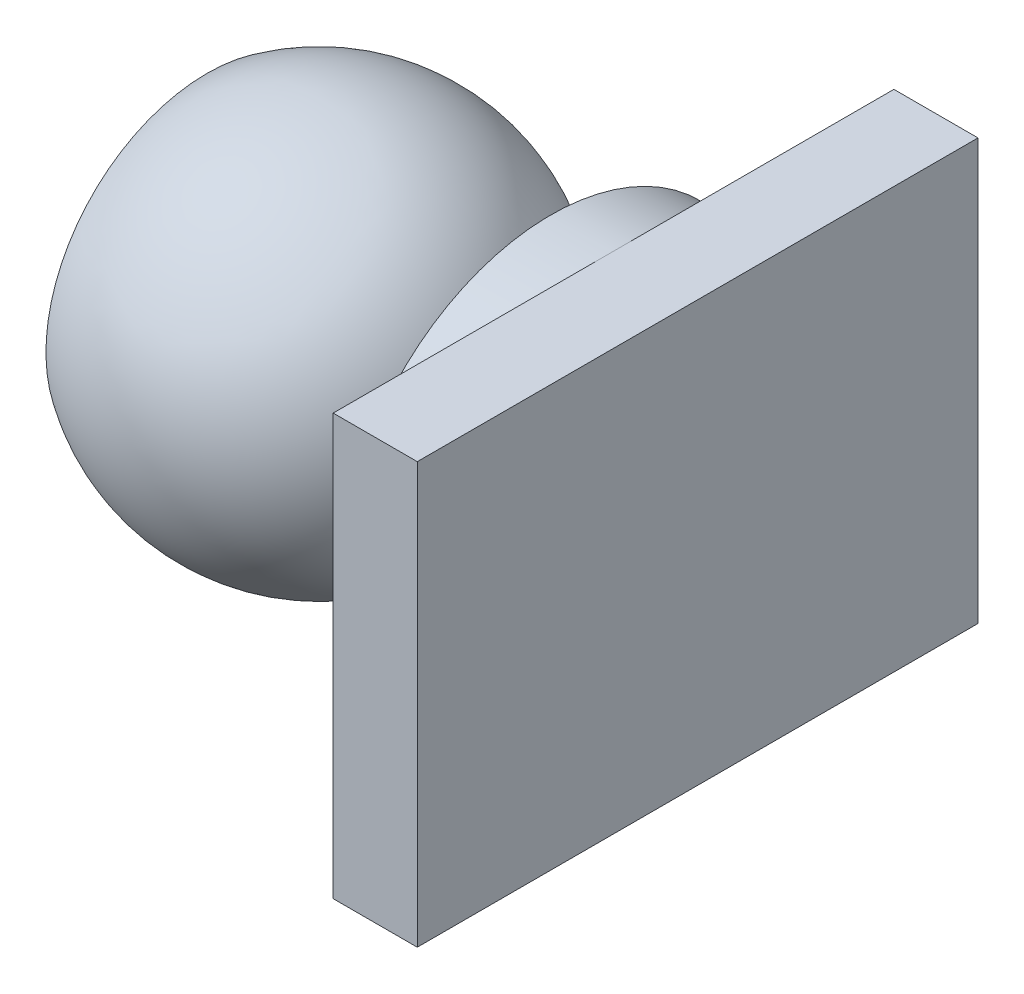
from build123d import *

# Parameters (mm, degrees)
VACIADO1_T              = -0.5
CROQUIS3_W              = 20
CROQUIS3_H              = 15
SALIENTE_EXTRUIR1_DEPTH = 3


with BuildPart() as part:
    # Croquis1 → Revolución1 (revolve)
    with BuildSketch(Plane.XY):
        with BuildLine():
            Line((5.855337127, 0), (-5.144662873, 0))
            Line((-5.144662873, 0), (-5.144662873, 5.744562647))
            ThreePointArc((-5.144662873, 5.744562647), (2.095707476, 6.204836823), (5.855337127, 0))
        make_face()
    revolve(axis=Axis((5.855337127, 0, 0), (-1, 0, 0)))

    # Vaciado1
    vaciado1_openings = [part.faces().sort_by_distance(p)[0] for p in [
        (-5.144662873, 0, 0),
    ]]
    offset(amount=VACIADO1_T, openings=vaciado1_openings, kind=Kind.INTERSECTION)

    # Croquis2 → Revolución2 (revolve)
    with BuildSketch(Plane.XY, mode=Mode.PRIVATE) as revoluci_n2_sk:
        with BuildLine():
            Line((5.855337127, 0), (9.355337127, 0))
            Line((9.355337127, 0), (9.355337127, -7.5))
            Line((9.355337127, -7.5), (7.115337127, -7.5))
            ThreePointArc((7.115337127, -7.5), (6.711500505, -4.686879238), (5.532607443, -2.100966713))
            Line((5.532607443, -2.100966713), (5.855337127, 0))
        make_face()
    revolve(revoluci_n2_sk.sketch.rotate(Axis((0, 0, 0), (1, 0, 0)), 180), axis=Axis((0, 0, 0), (1, 0, 0)))

    # Croquis3 → Saliente-Extruir1 (add)
    with BuildSketch(Plane(origin=(9.355337127, 0, 0), x_dir=(0, 0, -1), z_dir=(1, 0, 0))):
        Rectangle(CROQUIS3_W, CROQUIS3_H)
    extrude(amount=SALIENTE_EXTRUIR1_DEPTH)


solid = part.part
